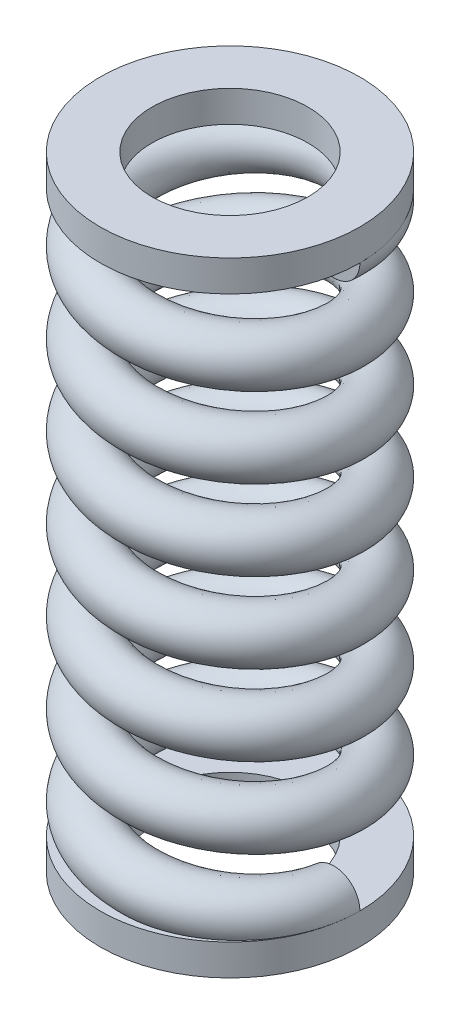
from build123d import *

# Parameters (mm, degrees)
SWEEP1_PITCH        = 3.857142857
SWEEP1_HEIGHT       = 27
SWEEP1_RADIUS       = 5
SWEEP1_START_ANGLE  = 90
SKETCH2_R           = 1.25
SKETCH3_R           = 6.25
SKETCH3_R_2         = 3.75
BOSS_EXTRUDE1_DEPTH = 1.5


with BuildPart() as part:
    # Sweep1: sweep along a helix
    with BuildLine() as sweep1_path:
        add(Helix(SWEEP1_PITCH, SWEEP1_HEIGHT, SWEEP1_RADIUS, center=(0, 0, 0), direction=(0, 1, 0), lefthand=True, mode=Mode.PRIVATE).rotate(Axis((0, 0, 0), (0, 1, 0)), SWEEP1_START_ANGLE))
    # Sketch2 → Sweep1 (sweep)
    with BuildSketch(Plane.XY):
        with Locations((5, 0)):
            Circle(SKETCH2_R)
    sweep(path=sweep1_path.line, is_frenet=True)

    # Sketch3 → Boss-Extrude1 (add)
    with BuildSketch(Plane(origin=(0, 0, 0), x_dir=(1, 0, 0), z_dir=(0, 1, 0))):
        with Locations(Location((0, 0, 0), (0, 0, 270))):
            Circle(SKETCH3_R)
        with Locations(Location((0, 0, 0), (0, 0, 270))):
            Circle(SKETCH3_R_2, mode=Mode.SUBTRACT)
    boss_extrude1 = extrude(amount=-BOSS_EXTRUDE1_DEPTH)

    # Mirror1: Boss-Extrude1 across plane
    add(boss_extrude1.mirror(Plane.ZX.offset(13.5)))


solid = part.part
